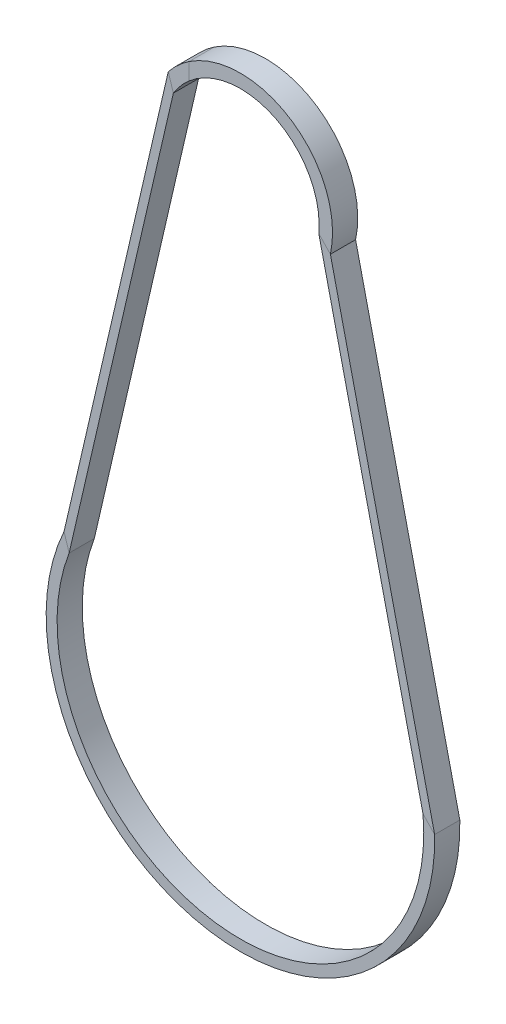
from build123d import *

# Parameters (mm, degrees)
SKETCH5_W = 3
SKETCH5_H = 2


with BuildPart() as part:
    # Sweep2: sweep along a path in Sketch2
    with BuildLine(Plane.XY) as sweep2_path:
        Line((10.386379851, 8.148013319), (22.796893852, -45.479962373))
        ThreePointArc((22.796893852, -45.479962373), (3.460906776, -69.801670494), (-15.875080301, -45.479962373))
        Line((-15.875080301, -45.479962373), (-3.4645663, 8.148013319))
        ThreePointArc((-3.4645663, 8.148013319), (3.460906776, 13.653829655), (10.386379851, 8.148013319))
    # Sketch5 → Sweep2 (sweep)
    with BuildSketch(Plane(origin=(-2.65, 0, 0), x_dir=(0, 0, -1), z_dir=(1, 0, 0))):
        with Locations((1.5, 14.653829655)):
            Rectangle(SKETCH5_W, SKETCH5_H)
    sweep(path=sweep2_path.line)


solid = part.part
